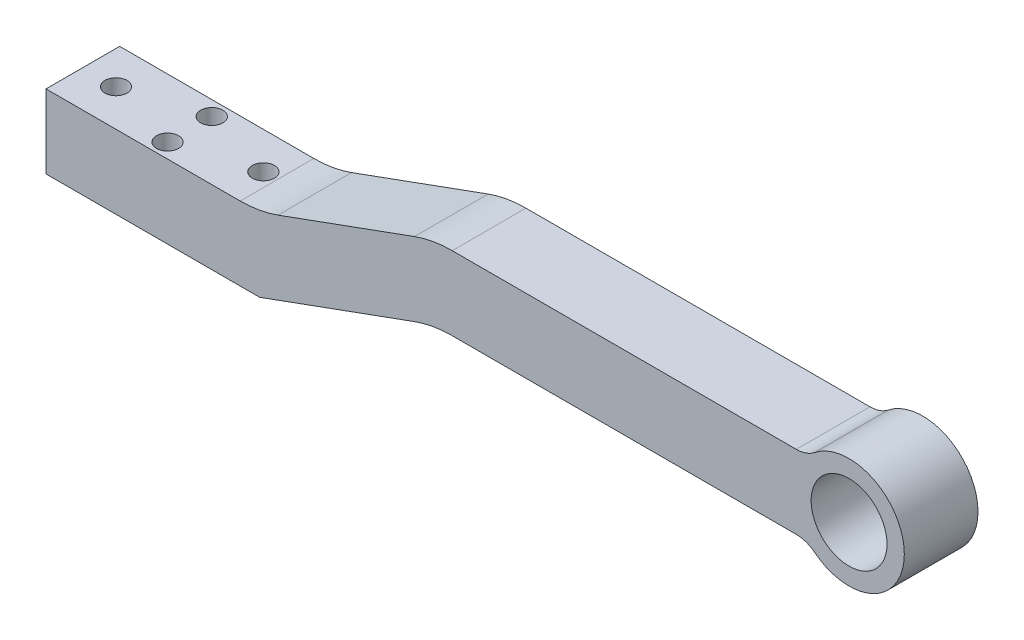
from build123d import *

# Parameters (mm, degrees)
MODEL_R             = 10.3
EXTRUDE_1_DEPTH     = 20
SKETCH_2_R          = 1.6
CUT_EXTRUDE_1_DEPTH = 20
SKETCH_3_R          = 3
CUT_EXTRUDE_2_DEPTH = 8.5


with BuildPart() as part:
    # Model → 凸台-拉伸1 (new body)
    with BuildSketch(Plane.XY):
        with BuildLine():
            Line((125.228900422, 213.510087452), (183.228900422, 213.510087452))
            Line((183.228900422, 213.510087452), (225.242736582, 228.801873242))
            ThreePointArc((225.242736582, 228.801873242), (230.293895552, 230.155327209), (235.503340882, 230.611094618))
            Line((235.503340882, 230.611094618), (328.909813266, 230.611094618))
            ThreePointArc((328.909813266, 230.611094618), (331.547600788, 230.163715156), (333.89036532, 228.871613865))
            ThreePointArc((333.89036532, 228.871613865), (358.22890041, 240.609493061), (333.891295649, 252.349301102))
            ThreePointArc((333.891295649, 252.349301102), (331.548694356, 251.057478239), (328.911168476, 250.610215048))
            Line((328.911168476, 250.610215048), (235.503478715, 250.611047476))
            ThreePointArc((235.503478715, 250.611047476), (230.293897677, 250.15530328), (225.242607062, 248.8018261))
            Line((225.242607062, 248.8018261), (188.1996953, 235.319308829))
            ThreePointArc((188.1996953, 235.319308829), (183.14853633, 233.965854862), (177.939091, 233.510087452))
            Line((177.939091, 233.510087452), (125.228900422, 233.510087452))
            Line((125.228900422, 233.510087452), (125.228900422, 213.510087452))
        make_face()
        with Locations((343.228900422, 240.610087452)):
            Circle(MODEL_R, mode=Mode.SUBTRACT)
    extrude(amount=EXTRUDE_1_DEPTH)

    # 草图2 → 切除-拉伸1 (cut)
    with BuildSketch(Plane.XZ.offset(-213.510087452)):
        with Locations((134.228900422, 10)):
            Circle(SKETCH_2_R)
        with Locations((174.228900422, 10)):
            Circle(SKETCH_2_R)
        with Locations((154.228900422, 16)):
            Circle(SKETCH_2_R)
        with Locations((154.228900422, 4)):
            Circle(SKETCH_2_R)
    extrude(amount=-CUT_EXTRUDE_1_DEPTH, mode=Mode.SUBTRACT)

    # 草图3 → 切除-拉伸2 (cut)
    with BuildSketch(Plane(origin=(0, 233.510087452, 0), x_dir=(1, 0, 0), z_dir=(0, 1, 0))):
        with Locations(Location((134.228900422, -10, 0), (0, 0, 270))):
            Circle(SKETCH_3_R)
        with Locations(Location((154.228900422, -4, 0), (0, 0, 270))):
            Circle(SKETCH_3_R)
        with Locations(Location((154.228900422, -16, 0), (0, 0, 270))):
            Circle(SKETCH_3_R)
        with Locations(Location((174.228900422, -10, 0), (0, 0, 270))):
            Circle(SKETCH_3_R)
    extrude(amount=-CUT_EXTRUDE_2_DEPTH, mode=Mode.SUBTRACT)


solid = part.part
